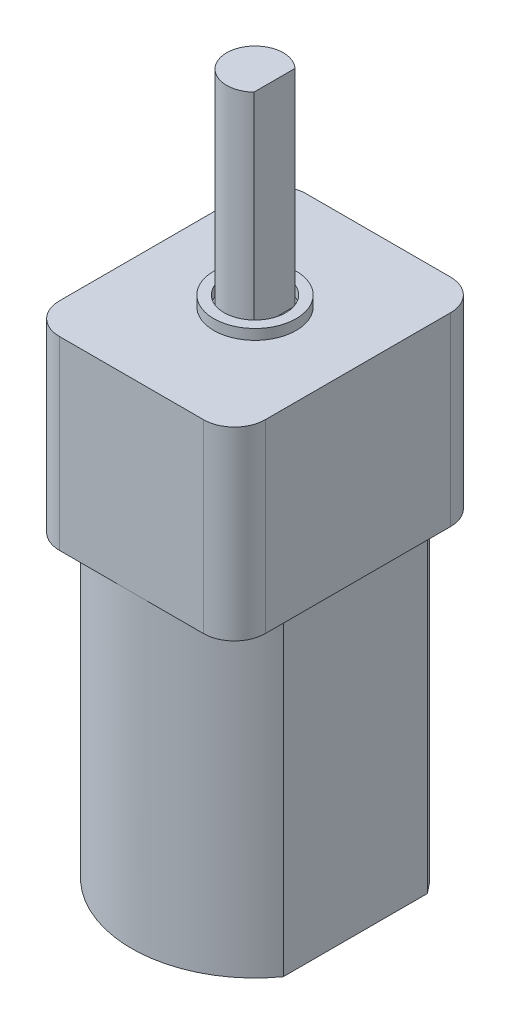
from build123d import *

# Parameters (mm, degrees)
EXTRUDE_1_DEPTH     = 15
SKETCH_2_W          = 10
SKETCH_2_H          = 12
EXTRUDE_2_DEPTH     = 9
FILLET_1_R          = 1.5
SKETCH_3_R          = 2
SKETCH_3_R_2        = 1.5
EXTRUDE_3_DEPTH     = 0.5
EXTRUDE_4_DEPTH     = 10
SKETCH_5_R          = 2.5
EXTRUDE_5_DEPTH     = 1.5
SKETCH_6_R          = 0.75
CUT_EXTRUDE_1_DEPTH = 0.5


with BuildPart() as part:
    # 草图1 → 凸台-拉伸1 (new body)
    with BuildSketch(Plane(origin=(0, 0, 0), x_dir=(1, 0, 0), z_dir=(0, 1, 0))):
        with BuildLine():
            Line((4.873397172, -3.5), (4.873397172, 3.5))
            ThreePointArc((4.873397172, 3.5), (0, 6), (-4.873397172, 3.5))
            Line((-4.873397172, 3.5), (-4.873397172, -3.5))
            ThreePointArc((-4.873397172, -3.5), (0, -6), (4.873397172, -3.5))
        make_face()
    extrude(amount=EXTRUDE_1_DEPTH)

    # 草图2 → 凸台-拉伸2 (add)
    with BuildSketch(Plane(origin=(0, 15, 0), x_dir=(1, 0, 0), z_dir=(0, 1, 0))):
        Rectangle(SKETCH_2_W, SKETCH_2_H)
    extrude(amount=EXTRUDE_2_DEPTH)

    # 圆角1
    fillet_1_edges = [part.edges().sort_by_distance(p)[0] for p in [
        (-5, 19.5, -6),
        (-5, 19.5, 6),
        (5, 19.5, 6),
        (5, 19.5, -6),
    ]]
    fillet(fillet_1_edges, radius=FILLET_1_R)

    # 草图3 → 凸台-拉伸3 (add)
    with BuildSketch(Plane(origin=(0, 24, 0), x_dir=(1, 0, 0), z_dir=(0, 1, 0))):
        with Locations(Location((0, 0, 0), (0, 0, 270))):
            Circle(SKETCH_3_R)
        with Locations(Location((0, 0, 0), (0, 0, 270))):
            Circle(SKETCH_3_R_2, mode=Mode.SUBTRACT)
    extrude(amount=EXTRUDE_3_DEPTH)

    # 草图4 → 凸台-拉伸4 (add)
    with BuildSketch(Plane(origin=(0, 24, 0), x_dir=(1, 0, 0), z_dir=(0, 1, 0))):
        with BuildLine():
            Line((0.943729304, 1), (0.943729304, -1))
            ThreePointArc((0.943729304, -1), (-1.375, 0), (0.943729304, 1))
        make_face()
    extrude(amount=EXTRUDE_4_DEPTH)

    # 草图5 → 凸台-拉伸5 (add)
    with BuildSketch(Plane.XZ):
        with Locations(Location((0, 0, 0), (0, 0, 270))):
            Circle(SKETCH_5_R)
    extrude(amount=EXTRUDE_5_DEPTH)

    # 草图6 → 切除-拉伸1 (cut)
    with BuildSketch(Plane.XZ.offset(1.5)):
        with Locations(Location((0, 0, 0), (0, 0, 270))):
            Circle(SKETCH_6_R)
    extrude(amount=-CUT_EXTRUDE_1_DEPTH, mode=Mode.SUBTRACT)


solid = part.part
